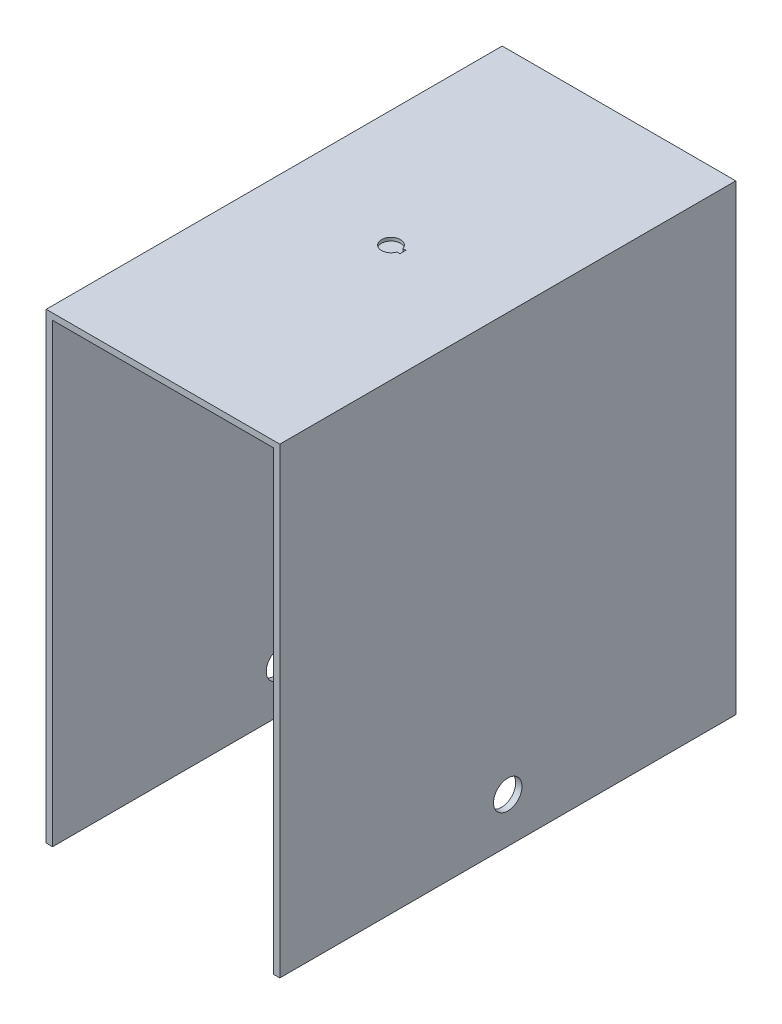
from build123d import *

# Parameters (mm, degrees)
SKETCH1_W           = 234.19
SKETCH1_H           = 457.2
BOSS_EXTRUDE1_DEPTH = 6.35
SKETCH2_W           = 6.35
SKETCH2_H           = 457.2
BOSS_EXTRUDE2_DEPTH = 457.2
SKETCH3_R           = 14.29
CUT_EXTRUDE1_DEPTH  = 558.8
CUT_EXTRUDE2_DEPTH  = 3.25


with BuildPart() as part:
    # Sketch1 → Boss-Extrude1 (new body)
    with BuildSketch(Plane(origin=(0, 0, 0), x_dir=(1, 0, 0), z_dir=(0, 1, 0))):
        Rectangle(SKETCH1_W, SKETCH1_H)
    extrude(amount=-BOSS_EXTRUDE1_DEPTH)

    # Sketch2 → Boss-Extrude2 (add)
    with BuildSketch(Plane.XZ.offset(6.35)):
        with Locations((-113.92, 0)):
            Rectangle(SKETCH2_W, SKETCH2_H)
    boss_extrude2 = extrude(amount=BOSS_EXTRUDE2_DEPTH)

    # Mirror1: Boss-Extrude2 across plane
    add(boss_extrude2.mirror(Plane(origin=(0, 0, 0), x_dir=(0, 0, 1), z_dir=(1, 0, 0))))

    # Sketch3 → Cut-Extrude1 (cut)
    with BuildSketch(Plane(origin=(117.095, 0, 0), x_dir=(0, 0, -1), z_dir=(1, 0, 0))):
        with Locations((0, -418.55)):
            Circle(SKETCH3_R)
    extrude(amount=-CUT_EXTRUDE1_DEPTH, mode=Mode.SUBTRACT)

    # Sketch4 → Cut-Extrude2 (cut)
    with BuildSketch(Plane(origin=(0, 0, 0), x_dir=(1, 0, 0), z_dir=(0, 1, 0))):
        with BuildLine():
            Line((9.013878189, 3), (12, 3))
            Line((12, 3), (12, -3))
            Line((12, -3), (9.013878189, -3))
            ThreePointArc((9.013878189, -3), (-9.5, 0), (9.013878189, 3))
        make_face()
    extrude(amount=-CUT_EXTRUDE2_DEPTH, mode=Mode.SUBTRACT)


solid = part.part
